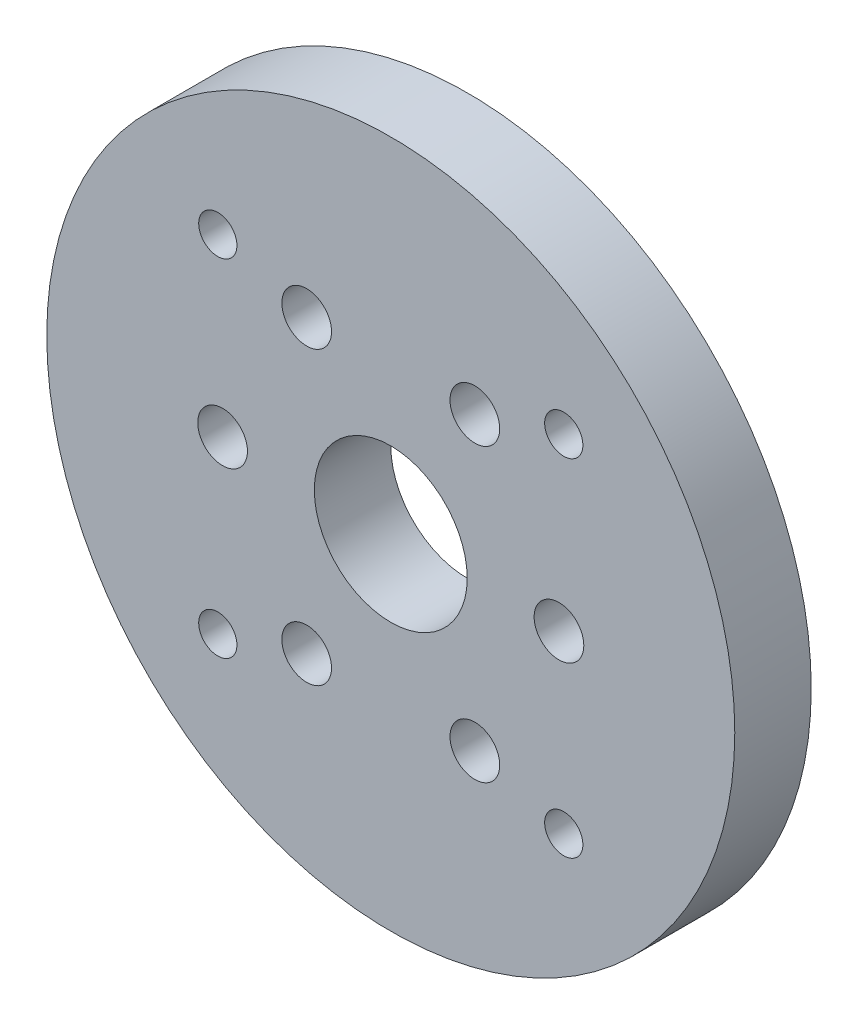
from build123d import *

# Parameters (mm, degrees)
SKETCH_1_R          = 45
EXTRUDE_1_DEPTH     = 10
SKETCH_2_R          = 10
SKETCH_2_R_2        = 3.25
SKETCH_2_R_3        = 2.5
CUT_EXTRUDE_1_DEPTH = 11


with BuildPart() as part:
    # 草图1 → 凸台-拉伸1 (new body)
    with BuildSketch(Plane.XY):
        Circle(SKETCH_1_R)
    extrude(amount=EXTRUDE_1_DEPTH)

    # 草图2 → 切除-拉伸1 (cut)
    with BuildSketch(Plane(origin=(0, 0, 0), x_dir=(-1, 0, 0), z_dir=(0, 0, -1))):
        Circle(SKETCH_2_R)
        with Locations((-22, 0)):
            Circle(SKETCH_2_R_2)
        with Locations((-11, 19.052558883)):
            Circle(SKETCH_2_R_2)
        with Locations((11, 19.052558883)):
            Circle(SKETCH_2_R_2)
        with Locations((22, 0)):
            Circle(SKETCH_2_R_2)
        with Locations((11, -19.052558883)):
            Circle(SKETCH_2_R_2)
        with Locations((-11, -19.052558883)):
            Circle(SKETCH_2_R_2)
        with Locations((-22.627416998, 22.627416998)):
            Circle(SKETCH_2_R_3)
        with Locations((22.627416998, 22.627416998)):
            Circle(SKETCH_2_R_3)
        with Locations((22.627416998, -22.627416998)):
            Circle(SKETCH_2_R_3)
        with Locations((-22.627416998, -22.627416998)):
            Circle(SKETCH_2_R_3)
    extrude(amount=-CUT_EXTRUDE_1_DEPTH, mode=Mode.SUBTRACT)


solid = part.part
